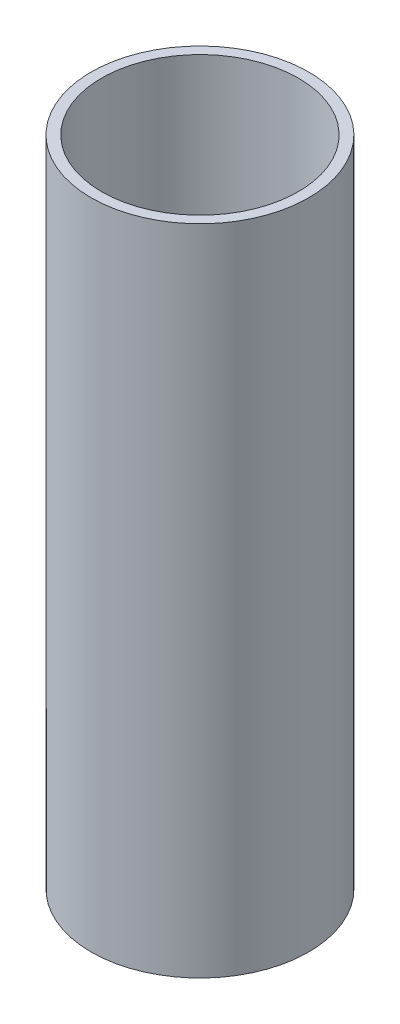
from build123d import *

# Parameters (mm, degrees)
SKETCH1_R           = 25
SKETCH1_R_2         = 22.6
BOSS_EXTRUDE1_DEPTH = 150


with BuildPart() as part:
    # Sketch1 → Boss-Extrude1 (new body)
    with BuildSketch(Plane(origin=(0, 0, 0), x_dir=(1, 0, 0), z_dir=(0, 1, 0))):
        with Locations(Location((0, 0, 0), (0, 0, 270))):
            Circle(SKETCH1_R)
        with Locations(Location((0, 0, 0), (0, 0, 270))):
            Circle(SKETCH1_R_2, mode=Mode.SUBTRACT)
    extrude(amount=BOSS_EXTRUDE1_DEPTH)


solid = part.part
